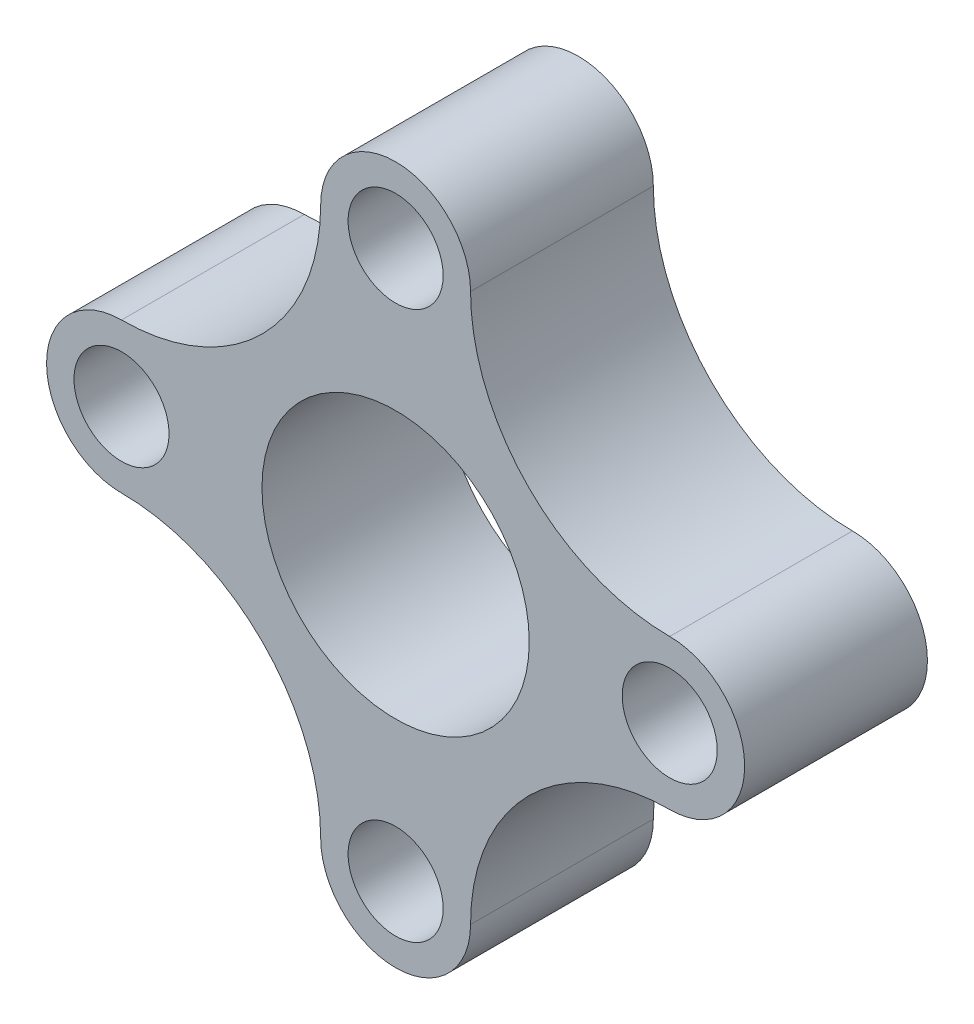
from build123d import *

# Parameters (mm, degrees)
AUFSATZ_LINEAR_AUSTRAGEN1_DEPTH = 10
SKIZZE2_R                       = 2.6
SCHNITT_LINEAR_AUSTRAGEN2_DEPTH = 10
SKIZZE3_R                       = 7.311453451
SCHNITT_LINEAR_AUSTRAGEN4_DEPTH = 10


with BuildPart() as part:
    # Skizze1 → Aufsatz-Linear austragen1 (new body)
    with BuildSketch(Plane.XY):
        with BuildLine():
            Line((0, 19.095775163), (0, 0))
            Line((0, 0), (19.095775163, 0))
            ThreePointArc((19.095775163, 0), (17.894912966, 2.899137803), (14.995775163, 4.1))
            ThreePointArc((14.995775163, 4.1), (7.291298659, 7.291298659), (4.1, 14.995775163))
            ThreePointArc((4.1, 14.995775163), (2.899137803, 17.894912966), (0, 19.095775163))
        make_face()
    extrude(amount=AUFSATZ_LINEAR_AUSTRAGEN1_DEPTH)

    # Spiegeln1: part across plane


with BuildPart() as part_1:
    add(part.part)
    add(part.part.mirror(Plane.ZX))

    # Spiegeln2: part across plane


with BuildPart() as part_2:
    add(part_1.part)
    add(part_1.part.mirror(Plane(origin=(0, 0, 0), x_dir=(0, 0, 1), z_dir=(1, 0, 0))))

    # Skizze2 → Schnitt-Linear austragen2 (cut)
    with BuildSketch(Plane.XY):
        with Locations((0, 14.995775163)):
            Circle(SKIZZE2_R)
        with Locations((14.995775163, 0)):
            Circle(SKIZZE2_R)
        with Locations((0, -14.995775163)):
            Circle(SKIZZE2_R)
        with Locations((-14.995775163, 0)):
            Circle(SKIZZE2_R)
    extrude(amount=SCHNITT_LINEAR_AUSTRAGEN2_DEPTH, mode=Mode.SUBTRACT)

    # Skizze3 → Schnitt-Linear austragen4 (cut)
    with BuildSketch(Plane.XY):
        Circle(SKIZZE3_R)
    extrude(amount=SCHNITT_LINEAR_AUSTRAGEN4_DEPTH, mode=Mode.SUBTRACT)


solid = part_2.part
